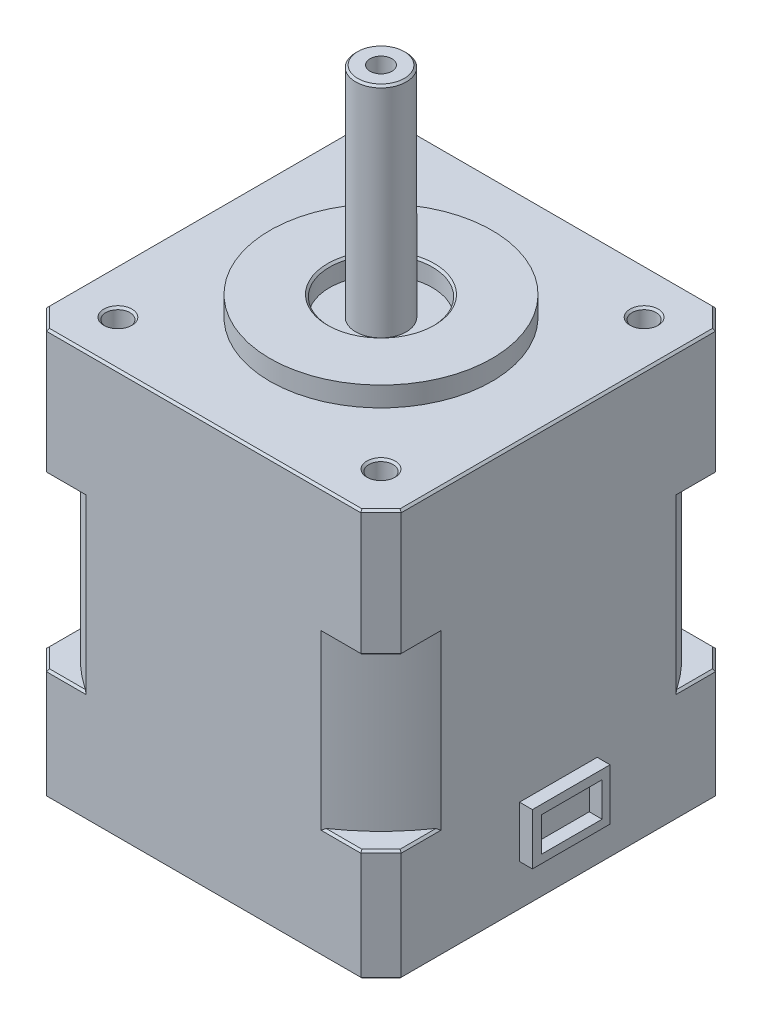
from build123d import *

# Parameters (mm, degrees)
SKETCH1_W                = 35.052
SKETCH1_H                = 40.1574
BOSS_EXTRUDE1_DEPTH      = 35.052
CUT_EXTRUDE1_DEPTH       = 16.6878
CUT_EXTRUDE2_DEPTH       = 16.6878
CUT_EXTRUDE3_DEPTH       = 16.6878
CUT_EXTRUDE4_START       = -16.6878
CUT_EXTRUDE4_DEPTH       = 16.6878
SKETCH6_W                = 7.6708
SKETCH6_H                = 5.08
BOSS_EXTRUDE2_DEPTH      = 1.27
SKETCH7_W                = 5.999755797
SKETCH7_H                = 3.380210023
CUT_EXTRUDE5_DEPTH       = 1.27
SKETCH8_R                = 10.9728
BOSS_EXTRUDE3_DEPTH      = 1.9558
HOLE1_D                  = 10.16
HOLE1_DEPTH              = 1.9558
SKETCH11_W               = 2.5
SKETCH11_H               = 21.59
M8_CLEARANCE_HOLE1_D     = 9.398
M8_CLEARANCE_HOLE1_DEPTH = 1.27
M2_CLEARANCE_HOLE1_D     = 2.3876
M2_CLEARANCE_HOLE1_DEPTH = 7.62
HOLE2_D                  = 2.159089633
HOLE2_DEPTH              = 2.54
CHAMFER1_SIZE            = 2
CHAMFER2_SIZE            = 0.2


with BuildPart() as part:
    # Sketch1 → Boss-Extrude1 (new body)
    with BuildSketch(Plane(origin=(0, 0, 0), x_dir=(0, 0, -1), z_dir=(1, 0, 0))):
        with Locations((-17.526, 20.0787)):
            Rectangle(SKETCH1_W, SKETCH1_H)
    extrude(amount=-BOSS_EXTRUDE1_DEPTH)

    # Sketch2 → Cut-Extrude1 (cut)
    with BuildSketch(Plane(origin=(0, 27.7114, 0), x_dir=(1, 0, 0), z_dir=(0, 1, 0))):
        with BuildLine():
            Line((0, -5.923557746), (0, 0))
            Line((0, 0), (-5.923557746, 0))
            ThreePointArc((-5.923557746, 0), (-2.66367612, -2.66367612), (0, -5.923557746))
        make_face()
    extrude(amount=-CUT_EXTRUDE1_DEPTH, mode=Mode.SUBTRACT)

    # Sketch3 → Cut-Extrude2 (cut)
    with BuildSketch(Plane(origin=(0, 27.7114, 0), x_dir=(1, 0, 0), z_dir=(0, 1, 0))):
        with BuildLine():
            Line((-29.128442254, 0), (-35.052, 0))
            Line((-35.052, 0), (-35.052, -5.923557746))
            ThreePointArc((-35.052, -5.923557746), (-32.38832388, -2.66367612), (-29.128442254, 0))
        make_face()
    extrude(amount=-CUT_EXTRUDE2_DEPTH, mode=Mode.SUBTRACT)

    # Sketch4 → Cut-Extrude3 (cut)
    with BuildSketch(Plane(origin=(0, 27.7114, 0), x_dir=(1, 0, 0), z_dir=(0, 1, 0))):
        with BuildLine():
            Line((-35.052, -29.128442254), (-35.052, -35.052))
            Line((-35.052, -35.052), (-29.128442254, -35.052))
            ThreePointArc((-29.128442254, -35.052), (-32.38832388, -32.38832388), (-35.052, -29.128442254))
        make_face()
    extrude(amount=-CUT_EXTRUDE3_DEPTH, mode=Mode.SUBTRACT)

    # Sketch5 → Cut-Extrude4 (cut)
    with BuildSketch(Plane.XZ.offset(-11.0236).offset(CUT_EXTRUDE4_START)):
        with BuildLine():
            Line((0, 29.128442254), (0, 35.052))
            Line((0, 35.052), (-5.923557746, 35.052))
            ThreePointArc((-5.923557746, 35.052), (-2.66367612, 32.38832388), (0, 29.128442254))
        make_face()
    extrude(amount=CUT_EXTRUDE4_DEPTH, mode=Mode.SUBTRACT)

    # Sketch6 → Boss-Extrude2 (add)
    with BuildSketch(Plane(origin=(0, 0, 0), x_dir=(0, 0, -1), z_dir=(1, 0, 0))):
        with Locations((-17.526, 6.804)):
            Rectangle(SKETCH6_W, SKETCH6_H)
    extrude(amount=BOSS_EXTRUDE2_DEPTH)

    # Sketch7 → Cut-Extrude5 (cut)
    with BuildSketch(Plane(origin=(1.27, 0, 0), x_dir=(0, 0, -1), z_dir=(1, 0, 0))):
        with Locations((-17.472522102, 6.764894989)):
            Rectangle(SKETCH7_W, SKETCH7_H)
    extrude(amount=-CUT_EXTRUDE5_DEPTH, mode=Mode.SUBTRACT)

    # Sketch8 → Boss-Extrude3 (add)
    with BuildSketch(Plane(origin=(0, 40.1574, 0), x_dir=(-1, 0, 0), z_dir=(0, 1, 0))):
        with Locations(Location((17.526, 17.526, 0), (0, 0, 90))):
            Circle(SKETCH8_R)
    extrude(amount=BOSS_EXTRUDE3_DEPTH)

    # Hole1
    with Locations(Plane(origin=(0, 42.1132, 0), x_dir=(1, 0, 0), z_dir=(0, 1, 0))):
        with Locations((-17.526, -17.526)):
            Hole(HOLE1_D / 2, depth=HOLE1_DEPTH)

    # Sketch11 → Revolve1 (revolve)
    with BuildSketch(Plane(origin=(0, 0, 17.526), x_dir=(-1, 0, 0), z_dir=(0, 0, -1)), mode=Mode.PRIVATE) as revolve1_sk:
        with Locations((16.276, 50.9524)):
            Rectangle(SKETCH11_W, SKETCH11_H)
    revolve(revolve1_sk.sketch.rotate(Axis((-17.526, 40.1574, 17.526), (0, 1, 0)), 270), axis=Axis((-17.526, 40.1574, 17.526), (0, 1, 0)))

    # M8 Clearance Hole1
    with Locations(Plane(origin=(0, 0, 0), x_dir=(-1, 0, 0), z_dir=(0, -1, 0))):
        with Locations((17.526, -17.526)):
            Hole(M8_CLEARANCE_HOLE1_D / 2, depth=M8_CLEARANCE_HOLE1_DEPTH)

    # M2 Clearance Hole1
    with Locations(Plane(origin=(0, 40.1574, 0), x_dir=(1, 0, 0), z_dir=(0, 1, 0))):
        with Locations((-4.5308, -30.5212), (-30.5308, -4.5212), (-30.5308, -30.5212), (-4.5308, -4.5212)):
            Hole(M2_CLEARANCE_HOLE1_D / 2, depth=M2_CLEARANCE_HOLE1_DEPTH)

    # Hole2
    with Locations(Plane(origin=(0, 61.7474, 0), x_dir=(1, 0, 0), z_dir=(0, 1, 0))):
        with Locations((-17.526, -17.526)):
            Hole(HOLE2_D / 2, depth=HOLE2_DEPTH)

    # Chamfer1
    chamfer1_edges = [part.edges().sort_by_distance(p)[0] for p in [
        (-35.052, 5.5118, 0),
        (0, 33.9344, 0),
        (-35.052, 33.9344, 0),
        (-35.052, 5.5118, 35.052),
        (-35.052, 33.9344, 35.052),
        (0, 5.5118, 35.052),
        (0, 5.5118, 0),
        (0, 33.9344, 35.052),
    ]]
    chamfer(chamfer1_edges, length=CHAMFER1_SIZE)

    # Chamfer2
    chamfer2_edges = [part.edges().sort_by_distance(p)[0] for p in [
        (-3.337, 40.1574, 4.5212),
        (-29.337, 40.1574, 30.5212),
        (-29.337, 40.1574, 4.5212),
        (-3.337, 40.1574, 30.5212),
        (-3.961778873, 27.7114, 35.052),
        (-17.526, 40.1574, 35.052),
        (-31.090221127, 27.7114, 35.052),
        (-31.090221127, 11.0236, 35.052),
        (-17.526, 0, 35.052),
        (-3.961778873, 11.0236, 35.052),
        (-34.052, 27.7114, 34.052),
        (-35.052, 40.1574, 17.526),
        (-35.052, 27.7114, 3.961778873),
        (-35.052, 11.0236, 3.961778873),
        (-35.052, 0, 17.526),
        (0, 40.1574, 17.526),
        (-17.526, 40.1574, 0),
        (-1, 40.1574, 34.052),
        (-34.052, 40.1574, 1),
        (-1, 40.1574, 1),
        (-34.052, 40.1574, 34.052),
        (0, 0, 17.526),
        (-17.526, 0, 0),
        (-34.052, 0, 34.052),
        (-1, 0, 1),
        (-34.052, 0, 1),
        (-1, 0, 34.052),
        (-1, 11.0236, 34.052),
        (-3.961778873, 27.7114, 0),
        (-3.961778873, 11.0236, 0),
        (-34.052, 11.0236, 1),
        (-1, 27.7114, 1),
        (-1, 11.0236, 1),
        (-34.052, 27.7114, 1),
        (-1, 27.7114, 34.052),
        (-34.052, 11.0236, 34.052),
        (0, 11.0236, 3.961778873),
        (0, 27.7114, 3.961778873),
        (-31.090221127, 11.0236, 0),
        (-31.090221127, 27.7114, 0),
        (-35.052, 11.0236, 31.090221127),
        (-35.052, 27.7114, 31.090221127),
        (0, 27.7114, 31.090221127),
        (0, 11.0236, 31.090221127),
        (-12.446, 42.1132, 17.526),
        (-17.526, 61.7474, 15.026),
    ]]
    chamfer(chamfer2_edges, length=CHAMFER2_SIZE)


solid = part.part
